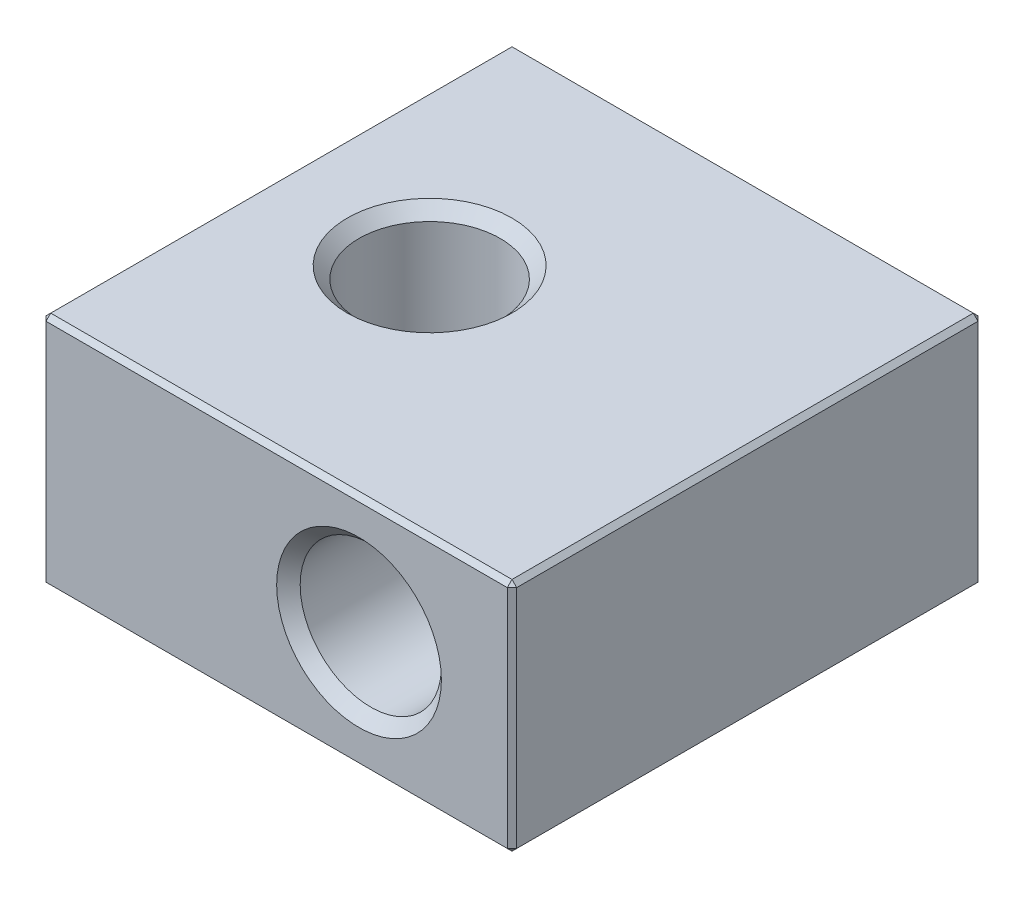
from build123d import *

# Parameters (mm, degrees)
SKETCH_1_W          = 20
SKETCH_1_H          = 20
SKETCH_1_R          = 3
EXTRUDE_1_DEPTH     = 10
SKETCH_2_R          = 3
CUT_EXTRUDE_1_DEPTH = 30.298841179
CHAMFER_3_SIZE      = 0.5
CHAMFER_4_SIZE      = 0.2


with BuildPart() as part:
    # 草图1 → 凸台-拉伸1 (new body)
    with BuildSketch(Plane(origin=(0, 0, 0), x_dir=(1, 0, 0), z_dir=(0, 1, 0))):
        with Locations((8.932038835, -3.155339806)):
            Rectangle(SKETCH_1_W, SKETCH_1_H)
        with Locations(Location((5.432038835, -3.155339806, 0), (0, 0, 270))):
            Circle(SKETCH_1_R, mode=Mode.SUBTRACT)
    extrude(amount=EXTRUDE_1_DEPTH)

    # 草图2 → 切除-拉伸1 (cut, through all)
    with BuildSketch(Plane(origin=(0, 0, -6.844660194), x_dir=(-1, 0, 0), z_dir=(0, 0, -1))):
        with Locations((-12.432038835, 5)):
            Circle(SKETCH_2_R)
    extrude(amount=-CUT_EXTRUDE_1_DEPTH, mode=Mode.SUBTRACT)

    # 倒角3
    chamfer_3_edges = [part.edges().sort_by_distance(p)[0] for p in [
        (5.432038835, 0, 0.155339806),
        (5.432038835, 10, 0.155339806),
        (15.432038835, 5, 13.155339806),
        (15.432038835, 5, -6.844660194),
    ]]
    chamfer(chamfer_3_edges, length=CHAMFER_3_SIZE)

    # 倒角4
    chamfer_4_edges = [part.edges().sort_by_distance(p)[0] for p in [
        (18.932038835, 10, 3.155339806),
        (8.932038835, 10, -6.844660194),
        (-1.067961165, 10, 3.155339806),
        (8.932038835, 0, -6.844660194),
        (18.932038835, 0, 3.155339806),
        (8.932038835, 0, 13.155339806),
        (-1.067961165, 0, 3.155339806),
        (8.932038835, 10, 13.155339806),
        (-1.067961165, 5, -6.844660194),
        (18.932038835, 5, -6.844660194),
        (18.932038835, 5, 13.155339806),
        (-1.067961165, 5, 13.155339806),
    ]]
    chamfer(chamfer_4_edges, length=CHAMFER_4_SIZE)


solid = part.part
